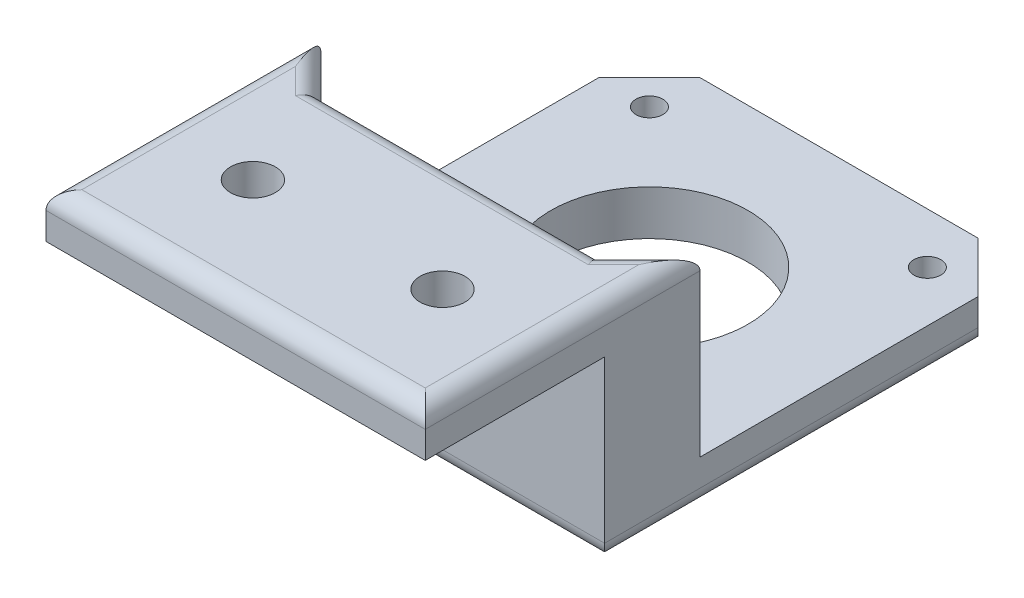
from build123d import *

# Parameters (mm, degrees)
EXTRUDE_1_DEPTH     = 42.3
SKETCH_2_R          = 11
SKETCH_2_R_2        = 1.5
SKETCH_2_R_3        = 2.5
CUT_EXTRUDE_1_DEPTH = 84.328146505
EXTRUDE_2_DEPTH     = 20
FILLET_1_R          = 2


with BuildPart() as part:
    # 스케치1 → 보스-돌출1 (new body)
    with BuildSketch(Plane(origin=(0, 0, 0), x_dir=(0, 0, -1), z_dir=(1, 0, 0))):
        Polygon((0, 5), (0, 0), (20, 0), (20, -20), (67.3, -20), (67.3, -15), (25, -15), (25, 5), align=None)
    extrude(amount=EXTRUDE_1_DEPTH)

    # 스케치2 → 컷-돌출1 (cut, through all)
    with BuildSketch(Plane(origin=(0, 5, 0), x_dir=(1, 0, 0), z_dir=(0, 1, 0))):
        Polygon((0, 61.65), (5.65, 67.3), (0, 67.3), align=None)
        Polygon((42.3, 67.3), (36.65, 67.3), (42.3, 61.65), align=None)
        with Locations(Location((21.15, 46.15, 0), (0, 0, 270))):
            Circle(SKETCH_2_R)
        with Locations(Location((5.65, 61.65, 0), (0, 0, 270))):
            Circle(SKETCH_2_R_2)
        with Locations(Location((36.65, 61.65, 0), (0, 0, 270))):
            Circle(SKETCH_2_R_2)
        with Locations(Location((5.65, 30.65, 0), (0, 0, 270))):
            Circle(SKETCH_2_R_2)
        with Locations(Location((36.65, 30.65, 0), (0, 0, 270))):
            Circle(SKETCH_2_R_2)
        with Locations(Location((10.575, 12.5, 0), (0, 0, 270))):
            Circle(SKETCH_2_R_3)
        with Locations(Location((31.725, 12.5, 0), (0, 0, 270))):
            Circle(SKETCH_2_R_3)
    extrude(amount=-CUT_EXTRUDE_1_DEPTH, mode=Mode.SUBTRACT)

    # 스케치2<4> → 보스-돌출2 (add)
    with BuildSketch(Plane(origin=(0, 5, 0), x_dir=(1, 0, 0), z_dir=(0, 1, 0))):
        Polygon((5.65, 25), (0, 30.65), (0, 25), align=None)
        Polygon((42.3, 25), (42.3, 30.65), (36.65, 25), align=None)
    extrude(amount=-EXTRUDE_2_DEPTH)

    # 필렛1
    fillet_1_edges = [part.edges().sort_by_distance(p)[0] for p in [
        (21.15, -20, -67.3),
        (42.3, -20, -40.825),
        (0, -20, -40.825),
        (21.15, -20, -20),
        (2.825, 5, -27.825),
        (21.15, 5, -25),
        (39.475, 5, -27.825),
        (21.15, 5, 0),
        (0, 5, -15.325),
        (42.3, 5, -15.325),
    ]]
    fillet(fillet_1_edges, radius=FILLET_1_R)


solid = part.part
